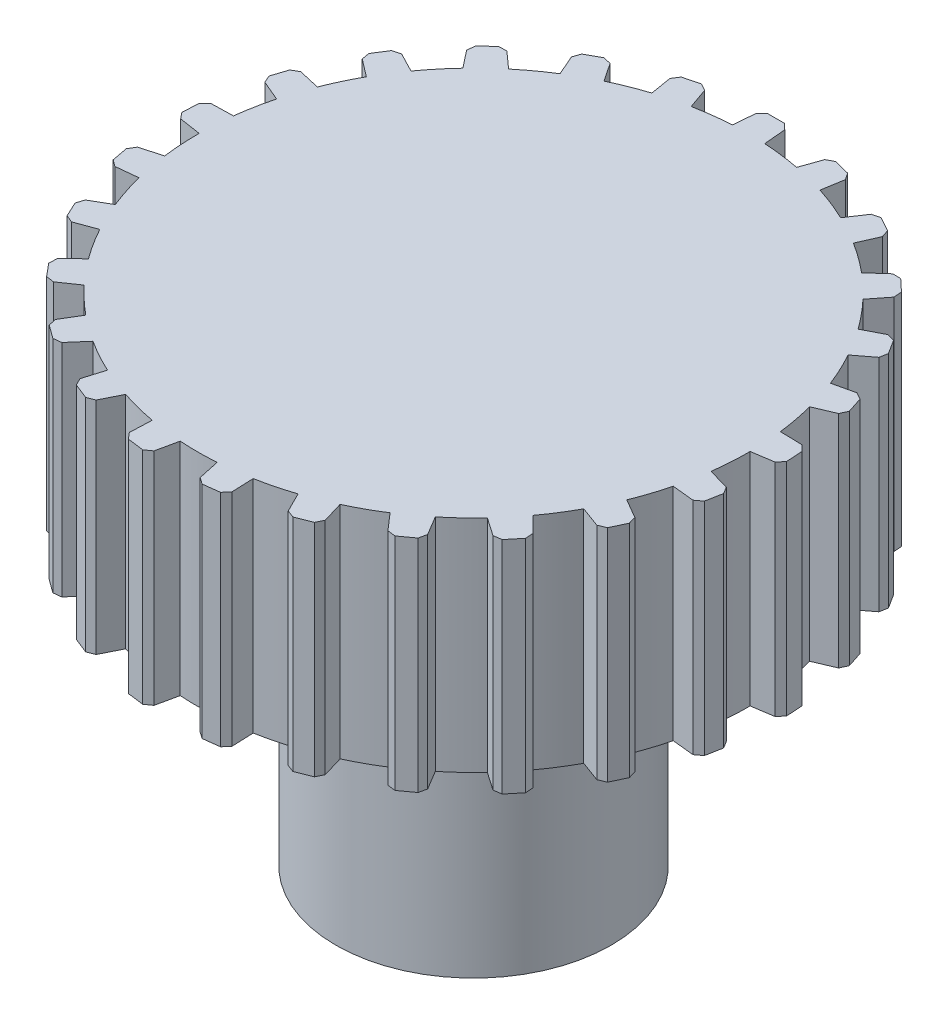
from build123d import *

# Parameters (mm, degrees)
SKETCH1_R           = 12.7
BOSS_EXTRUDE1_DEPTH = 10.16
BOSS_EXTRUDE2_START = -10.16
BOSS_EXTRUDE2_DEPTH = 10.16
CIRPATTERN1_COUNT   = 25
SKETCH3_R           = 6.35
BOSS_EXTRUDE3_DEPTH = 12.7
CUT_EXTRUDE1_DEPTH  = 6.35
FILLET1_R           = 1.27


with BuildPart() as part:
    # Sketch1 → Boss-Extrude1 (new body)
    with BuildSketch(Plane(origin=(0, 0, 0), x_dir=(1, 0, 0), z_dir=(0, 1, 0))):
        with Locations(Location((0, 0, 0), (0, 0, 270))):
            Circle(SKETCH1_R)
    extrude(amount=BOSS_EXTRUDE1_DEPTH)

    # Sketch2 → Boss-Extrude2 (add)
    with BuildSketch(Plane(origin=(0, 10.16, 0), x_dir=(1, 0, 0), z_dir=(0, 1, 0)).offset(BOSS_EXTRUDE2_START)):
        with BuildLine():
            Line((-0.745687793, 12.678089356), (-0.657137559, 13.690223169))
            Line((-0.657137559, 13.690223169), (-0.381, 13.943256622))
            Line((-0.381, 13.943256622), (0.381, 13.943256622))
            Line((0.381, 13.943256622), (0.657137559, 13.690223169))
            Line((0.657137559, 13.690223169), (0.745687793, 12.678089356))
            ThreePointArc((0.745687793, 12.678089356), (0, 12.7), (-0.745687793, 12.678089356))
        make_face()
    boss_extrude2 = extrude(amount=BOSS_EXTRUDE2_DEPTH)

    # CirPattern1: Boss-Extrude2 ×25 about axis
    cirpattern1_axis = Axis((0, 0, 0), (0, 1, 0))
    for i in range(1, CIRPATTERN1_COUNT):
        add(boss_extrude2.rotate(cirpattern1_axis, i * 360 / CIRPATTERN1_COUNT))

    # Sketch3 → Boss-Extrude3 (add)
    with BuildSketch(Plane.XZ):
        with Locations(Location((0, 0, 0), (0, 0, 90))):
            Circle(SKETCH3_R)
    extrude(amount=BOSS_EXTRUDE3_DEPTH)

    # Sketch4 → Cut-Extrude1 (cut)
    with BuildSketch(Plane.XZ.offset(12.7)):
        with BuildLine():
            Line((-1.425571464, 0.9525), (1.425571464, 0.9525))
            ThreePointArc((1.425571464, 0.9525), (0, -1.7145), (-1.425571464, 0.9525))
        make_face()
    extrude(amount=-CUT_EXTRUDE1_DEPTH, mode=Mode.SUBTRACT)

    # Fillet1
    fillet1_edges = [part.edges().sort_by_distance(p)[0] for p in [
        (0, 0, -6.35),
    ]]
    fillet(fillet1_edges, radius=FILLET1_R)


solid = part.part
